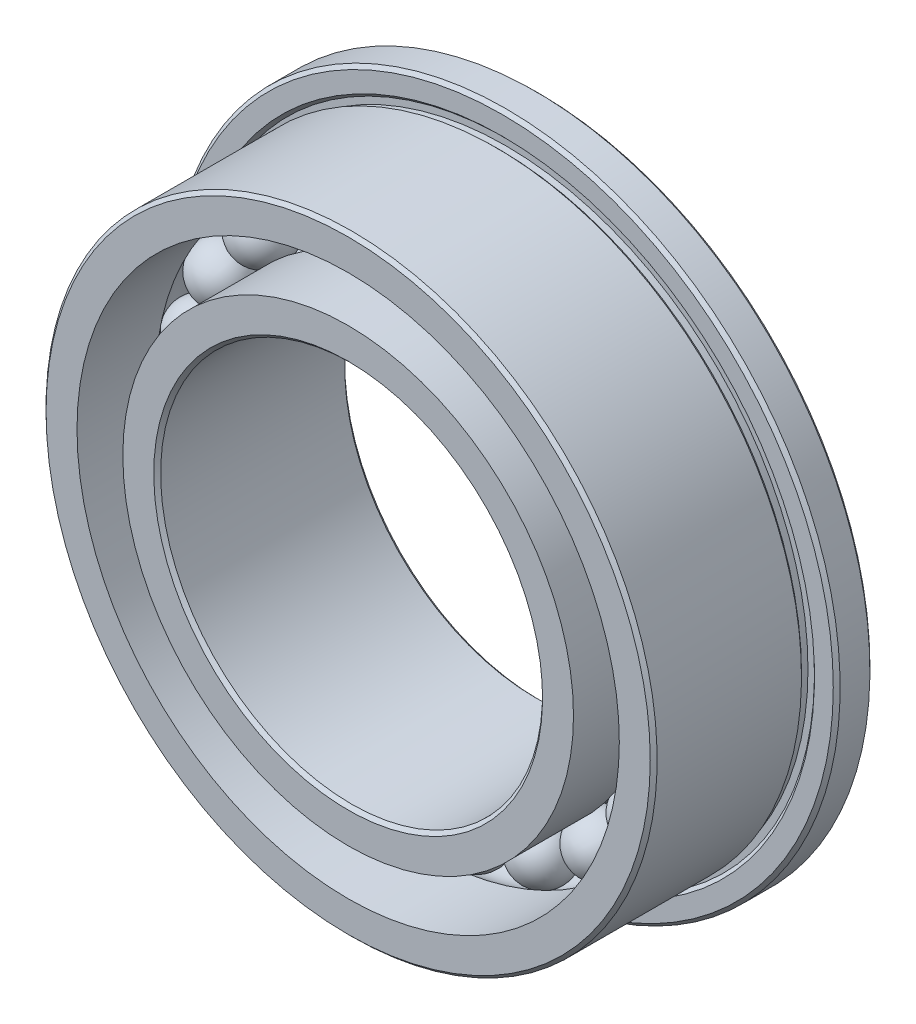
from build123d import *

# Parameters (mm, degrees)
FILLET1_SIZE      = 0.0714375
FILLET2_SIZE      = 0.0714375
CIRPATTERN3_COUNT = 23


with BuildPart() as part:
    # Sketch2 → Revolve1 (revolve)
    with BuildSketch(Plane(origin=(0, 0, 0), x_dir=(0, 0, -1), z_dir=(1, 0, 0)), mode=Mode.PRIVATE) as revolve1_sk:
        with BuildLine():
            Line((1.984375, 6.9469), (1.222375, 6.9469))
            Line((1.222375, 6.9469), (1.222375, 6.484703842))
            Line((1.222375, 6.484703842), (1.289726921, 6.417351921))
            Line((1.289726921, 6.417351921), (1.289726921, 6.282648079))
            Line((1.289726921, 6.282648079), (1.155023079, 6.282648079))
            Line((1.155023079, 6.282648079), (1.087671158, 6.35))
            Line((1.087671158, 6.35), (-1.984375, 6.35))
            Line((-1.984375, 6.35), (-1.984375, 5.635625))
            Line((-1.984375, 5.635625), (-0.3571875, 5.635625))
            ThreePointArc((-0.3571875, 5.635625), (0, 5.7546875), (0.3571875, 5.635625))
            Line((0.3571875, 5.635625), (1.984375, 5.635625))
            Line((1.984375, 5.635625), (1.984375, 6.9469))
        make_face()
        with BuildLine():
            Line((1.984375, 3.96875), (-1.984375, 3.96875))
            Line((-1.984375, 3.96875), (-1.984375, 4.683125))
            Line((-1.984375, 4.683125), (-0.3571875, 4.683125))
            ThreePointArc((-0.3571875, 4.683125), (0, 4.5640625), (0.3571875, 4.683125))
            Line((0.3571875, 4.683125), (1.984375, 4.683125))
            Line((1.984375, 4.683125), (1.984375, 3.96875))
        make_face()
    revolve(revolve1_sk.sketch.rotate(Axis((0, 0, 0), (0, 0, -1)), 180), axis=Axis((0, 0, 0), (0, 0, -1)))

    # Fillet1
    fillet1_edges = [part.edges().sort_by_distance(p)[0] for p in [
        (0, 6.35, 1.984375),
        (0, 6.9469, -1.984375),
        (0, 6.9469, -1.222375),
    ]]
    chamfer(fillet1_edges, length=FILLET1_SIZE)

    # Fillet2
    fillet2_edges = [part.edges().sort_by_distance(p)[0] for p in [
        (0, 3.96875, -1.984375),
        (0, 3.96875, 1.984375),
    ]]
    chamfer(fillet2_edges, length=FILLET2_SIZE)


with BuildPart() as body_2:
    # Sketch7 → Revolve3 (revolve)
    with BuildSketch(Plane.XY):
        with BuildLine():
            Line((0, 5.7546875), (0, 4.5640625))
            ThreePointArc((0, 4.5640625), (-0.5953125, 5.159375), (0, 5.7546875))
        make_face()
    revolve(axis=Axis((0, 5.7546875, 0), (0, -1, 0)))


with BuildPart() as cirpattern3_1:
    # CirPattern3: pattern copy
    add(body_2.part.rotate(Axis((0, 0, 0), (0, 0, 1)), 1 * 360 / CIRPATTERN3_COUNT))


with BuildPart() as cirpattern3_2:
    # CirPattern3: pattern copy
    add(body_2.part.rotate(Axis((0, 0, 0), (0, 0, 1)), 2 * 360 / CIRPATTERN3_COUNT))


with BuildPart() as cirpattern3_3:
    # CirPattern3: pattern copy
    add(body_2.part.rotate(Axis((0, 0, 0), (0, 0, 1)), 3 * 360 / CIRPATTERN3_COUNT))


with BuildPart() as cirpattern3_4:
    # CirPattern3: pattern copy
    add(body_2.part.rotate(Axis((0, 0, 0), (0, 0, 1)), 4 * 360 / CIRPATTERN3_COUNT))


with BuildPart() as cirpattern3_5:
    # CirPattern3: pattern copy
    add(body_2.part.rotate(Axis((0, 0, 0), (0, 0, 1)), 5 * 360 / CIRPATTERN3_COUNT))


with BuildPart() as cirpattern3_6:
    # CirPattern3: pattern copy
    add(body_2.part.rotate(Axis((0, 0, 0), (0, 0, 1)), 6 * 360 / CIRPATTERN3_COUNT))


with BuildPart() as cirpattern3_7:
    # CirPattern3: pattern copy
    add(body_2.part.rotate(Axis((0, 0, 0), (0, 0, 1)), 7 * 360 / CIRPATTERN3_COUNT))


with BuildPart() as cirpattern3_8:
    # CirPattern3: pattern copy
    add(body_2.part.rotate(Axis((0, 0, 0), (0, 0, 1)), 8 * 360 / CIRPATTERN3_COUNT))


with BuildPart() as cirpattern3_9:
    # CirPattern3: pattern copy
    add(body_2.part.rotate(Axis((0, 0, 0), (0, 0, 1)), 9 * 360 / CIRPATTERN3_COUNT))


with BuildPart() as cirpattern3_10:
    # CirPattern3: pattern copy
    add(body_2.part.rotate(Axis((0, 0, 0), (0, 0, 1)), 10 * 360 / CIRPATTERN3_COUNT))


with BuildPart() as cirpattern3_11:
    # CirPattern3: pattern copy
    add(body_2.part.rotate(Axis((0, 0, 0), (0, 0, 1)), 11 * 360 / CIRPATTERN3_COUNT))


with BuildPart() as cirpattern3_12:
    # CirPattern3: pattern copy
    add(body_2.part.rotate(Axis((0, 0, 0), (0, 0, 1)), 12 * 360 / CIRPATTERN3_COUNT))


with BuildPart() as cirpattern3_13:
    # CirPattern3: pattern copy
    add(body_2.part.rotate(Axis((0, 0, 0), (0, 0, 1)), 13 * 360 / CIRPATTERN3_COUNT))


with BuildPart() as cirpattern3_14:
    # CirPattern3: pattern copy
    add(body_2.part.rotate(Axis((0, 0, 0), (0, 0, 1)), 14 * 360 / CIRPATTERN3_COUNT))


with BuildPart() as cirpattern3_15:
    # CirPattern3: pattern copy
    add(body_2.part.rotate(Axis((0, 0, 0), (0, 0, 1)), 15 * 360 / CIRPATTERN3_COUNT))


with BuildPart() as cirpattern3_16:
    # CirPattern3: pattern copy
    add(body_2.part.rotate(Axis((0, 0, 0), (0, 0, 1)), 16 * 360 / CIRPATTERN3_COUNT))


with BuildPart() as cirpattern3_17:
    # CirPattern3: pattern copy
    add(body_2.part.rotate(Axis((0, 0, 0), (0, 0, 1)), 17 * 360 / CIRPATTERN3_COUNT))


with BuildPart() as cirpattern3_18:
    # CirPattern3: pattern copy
    add(body_2.part.rotate(Axis((0, 0, 0), (0, 0, 1)), 18 * 360 / CIRPATTERN3_COUNT))


with BuildPart() as cirpattern3_19:
    # CirPattern3: pattern copy
    add(body_2.part.rotate(Axis((0, 0, 0), (0, 0, 1)), 19 * 360 / CIRPATTERN3_COUNT))


with BuildPart() as cirpattern3_20:
    # CirPattern3: pattern copy
    add(body_2.part.rotate(Axis((0, 0, 0), (0, 0, 1)), 20 * 360 / CIRPATTERN3_COUNT))


with BuildPart() as cirpattern3_21:
    # CirPattern3: pattern copy
    add(body_2.part.rotate(Axis((0, 0, 0), (0, 0, 1)), 21 * 360 / CIRPATTERN3_COUNT))


with BuildPart() as cirpattern3_22:
    # CirPattern3: pattern copy
    add(body_2.part.rotate(Axis((0, 0, 0), (0, 0, 1)), 22 * 360 / CIRPATTERN3_COUNT))


solid = Compound([part.part, body_2.part, cirpattern3_1.part, cirpattern3_2.part, cirpattern3_3.part, cirpattern3_4.part, cirpattern3_5.part, cirpattern3_6.part, cirpattern3_7.part, cirpattern3_8.part, cirpattern3_9.part, cirpattern3_10.part, cirpattern3_11.part, cirpattern3_12.part, cirpattern3_13.part, cirpattern3_14.part, cirpattern3_15.part, cirpattern3_16.part, cirpattern3_17.part, cirpattern3_18.part, cirpattern3_19.part, cirpattern3_20.part, cirpattern3_21.part, cirpattern3_22.part])
